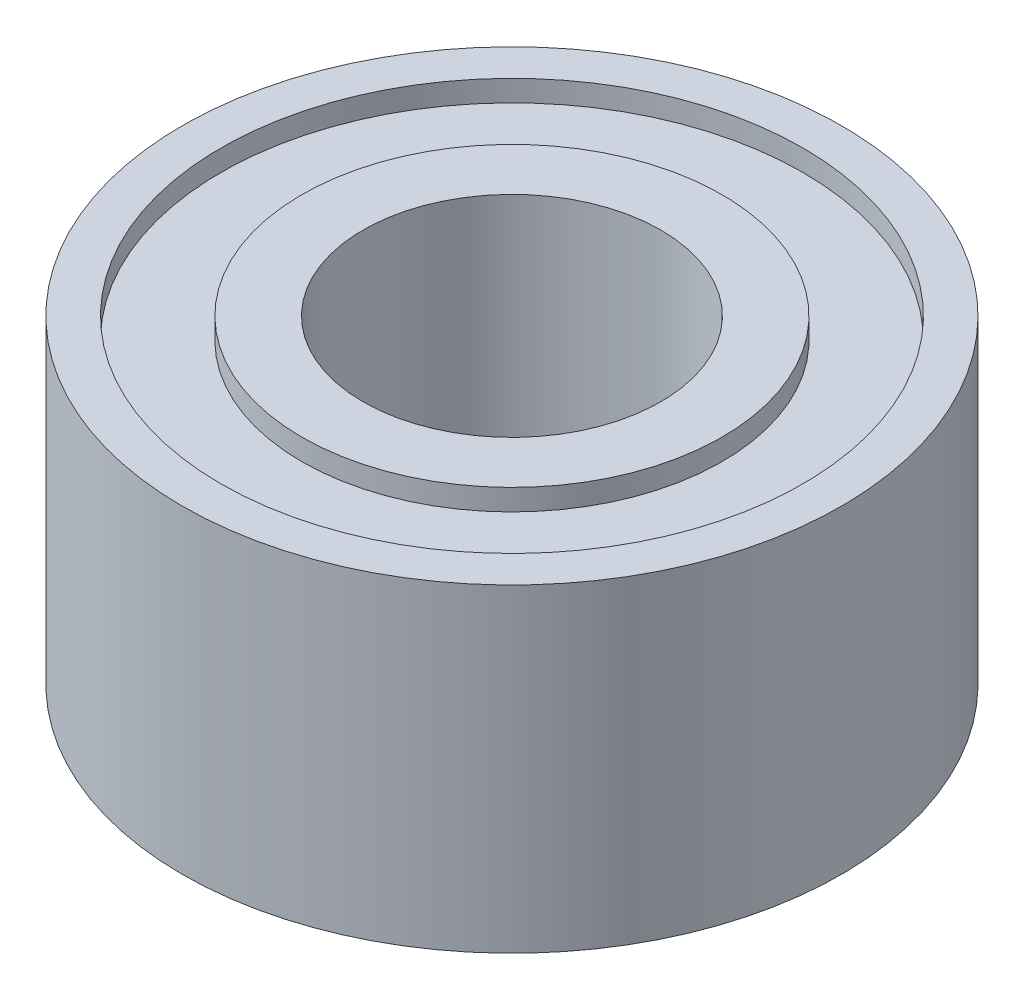
from build123d import *

# Parameters (mm, degrees)
SKETCH1_R           = 15.5
SKETCH1_R_2         = 7
BOSS_EXTRUDE1_DEPTH = 15
SKETCH5_R           = 13.684256987
SKETCH5_R_2         = 9.879532168
CUT_EXTRUDE3_DEPTH  = 1
CUT_EXTRUDE4_START  = -1
SKETCH6_R           = 13.684256987
SKETCH6_R_2         = 9.879532168
CUT_EXTRUDE4_DEPTH  = 1


with BuildPart() as part:
    # Sketch1 → Boss-Extrude1 (new body)
    with BuildSketch(Plane(origin=(0, 0, 0), x_dir=(1, 0, 0), z_dir=(0, 1, 0))):
        with Locations(Location((0, 0, 0), (0, 0, 270))):
            Circle(SKETCH1_R)
        with Locations(Location((0, 0, 0), (0, 0, 270))):
            Circle(SKETCH1_R_2, mode=Mode.SUBTRACT)
    extrude(amount=BOSS_EXTRUDE1_DEPTH)

    # Sketch5 → Cut-Extrude3 (cut)
    with BuildSketch(Plane(origin=(0, 15, 0), x_dir=(1, 0, 0), z_dir=(0, 1, 0))):
        with Locations(Location((0, 0, 0), (0, 0, 270))):
            Circle(SKETCH5_R)
        with Locations(Location((0, 0, 0), (0, 0, 270))):
            Circle(SKETCH5_R_2, mode=Mode.SUBTRACT)
    extrude(amount=-CUT_EXTRUDE3_DEPTH, mode=Mode.SUBTRACT)

    # Sketch6 → Cut-Extrude4 (cut)
    with BuildSketch(Plane.XZ.offset(CUT_EXTRUDE4_START)):
        with Locations(Location((0, 0, 0), (0, 0, 90))):
            Circle(SKETCH6_R)
        with Locations(Location((0, 0, 0), (0, 0, 90))):
            Circle(SKETCH6_R_2, mode=Mode.SUBTRACT)
    extrude(amount=CUT_EXTRUDE4_DEPTH, mode=Mode.SUBTRACT)


solid = part.part
